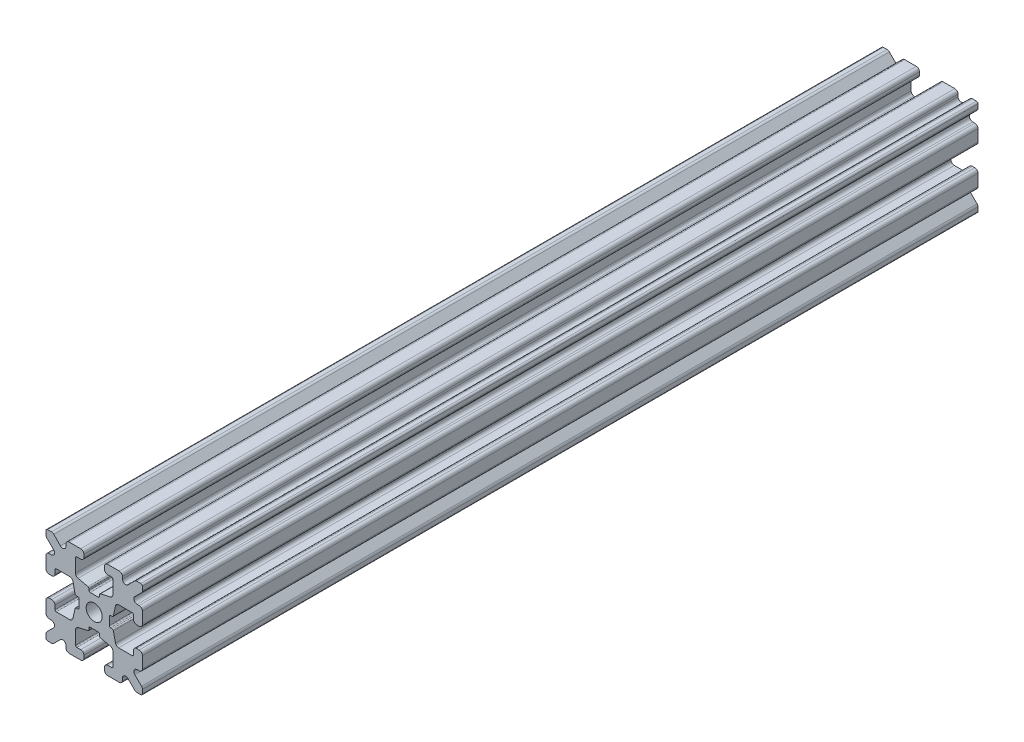
from build123d import *

# Parameters (mm, degrees)
SKETCH1_W           = 15
SKETCH1_H           = 15
SKETCH1_R           = 1.25
BOSS_EXTRUDE1_DEPTH = 65
FILLET1_R           = 0.25
CUT_EXTRUDE1_DEPTH  = 131.431974607
CUT_EXTRUDE3_DEPTH  = 131.431974607
FILLET3_R           = 0.5
FILLET4_R           = 0.5
FILLET5_R           = 3
FILLET6_R           = 0.2
CUT_EXTRUDE4_DEPTH  = 131.431974607
FILLET8_R           = 0.5
SKETCH6_W           = 5.1529354
SKETCH6_H           = 1.651
SKETCH6_W_2         = 1.651
SKETCH6_H_2         = 5.1529354
CUT_EXTRUDE5_DEPTH  = 131.431974607
FILLET10_R          = 0.2


with BuildPart() as part:
    # Sketch1 → Boss-Extrude1 (new, symmetric)
    with BuildSketch(Plane.XY):
        Rectangle(SKETCH1_W, SKETCH1_H)
        Circle(SKETCH1_R, mode=Mode.SUBTRACT)
    extrude(amount=BOSS_EXTRUDE1_DEPTH, both=True)

    # Fillet1
    fillet1_edges = [part.edges().sort_by_distance(p)[0] for p in [
        (7.5, -7.5, 0),
        (-7.5, -7.5, 0),
        (-7.5, 7.5, 0),
        (7.5, 7.5, 0),
    ]]
    fillet(fillet1_edges, radius=FILLET1_R)

    # Sketch2 → Cut-Extrude1 (cut, through all)
    with BuildSketch(Plane.XY.offset(65)):
        Polygon((-7.5, 1.6), (-6.1, 1.6), (-6.1, 2.9), (-3.4, 2.9), (-3.4, -2.9), (-6.1, -2.9), (-6.1, -1.6), (-7.5, -1.6), align=None)
        Polygon((2.9, 6.1), (1.6, 6.1), (1.6, 7.5), (-1.6, 7.5), (-1.6, 6.1), (-2.9, 6.1), (-2.9, 3.4), (2.9, 3.4), align=None)
        Polygon((-1.6, -7.5), (-1.6, -6.1), (-2.9, -6.1), (-2.9, -3.4), (2.9, -3.4), (2.9, -6.1), (1.6, -6.1), (1.6, -7.5), align=None)
        Polygon((6.1, -2.9), (6.1, -1.6), (7.5, -1.6), (7.5, 1.6), (6.1, 1.6), (6.1, 2.9), (3.4, 2.9), (3.4, -2.9), align=None)
    extrude(amount=-CUT_EXTRUDE1_DEPTH, mode=Mode.SUBTRACT)

    # Sketch4 → Cut-Extrude3 (cut, through all)
    with BuildSketch(Plane.XY.offset(65)):
        Polygon((-3.4, 2.9), (-2.75, 0), (-3.4, -2.9), align=None)
        Polygon((-2.9, 3.4), (0, 2.75), (2.9, 3.4), align=None)
        Polygon((3.4, 2.9), (2.75, 0), (3.4, -2.9), align=None)
        Polygon((-2.9, -3.4), (0, -2.75), (2.9, -3.4), align=None)
    extrude(amount=-CUT_EXTRUDE3_DEPTH, mode=Mode.SUBTRACT)

    # Fillet3
    fillet3_edges = [part.edges().sort_by_distance(p)[0] for p in [
        (1.6, -7.5, 0),
        (-1.6, -7.5, 0),
        (-1.6, -6.1, 0),
        (1.6, -6.1, 0),
        (6.1, 1.6, 0),
        (7.5, 1.6, 0),
        (7.5, -1.6, 0),
        (6.1, -1.6, 0),
        (-7.5, -1.6, 0),
        (-7.5, 1.6, 0),
        (-6.1, 1.6, 0),
        (-6.1, -1.6, 0),
        (-1.6, 6.1, 0),
        (-1.6, 7.5, 0),
        (1.6, 7.5, 0),
        (1.6, 6.1, 0),
    ]]
    fillet(fillet3_edges, radius=FILLET3_R)

    # Fillet4
    fillet4_edges = [part.edges().sort_by_distance(p)[0] for p in [
        (-2.9, -3.4, 0),
        (2.9, -3.4, 0),
        (3.4, -2.9, 0),
        (3.4, 2.9, 0),
        (-3.4, 2.9, 0),
        (-3.4, -2.9, 0),
        (2.9, 3.4, 0),
        (-2.9, 3.4, 0),
    ]]
    fillet(fillet4_edges, radius=FILLET4_R)

    # Fillet5
    fillet5_edges = [part.edges().sort_by_distance(p)[0] for p in [
        (-2.75, 0, 0),
        (0, 2.75, 0),
        (2.75, 0, 0),
        (0, -2.75, 0),
    ]]
    fillet(fillet5_edges, radius=FILLET5_R)

    # Fillet6
    fillet6_edges = [part.edges().sort_by_distance(p)[0] for p in [
        (-2.9, -6.1, 0),
        (2.9, -6.1, 0),
        (6.1, -2.9, 0),
        (6.1, 2.9, 0),
        (-6.1, 2.9, 0),
        (-6.1, -2.9, 0),
        (2.9, 6.1, 0),
        (-2.9, 6.1, 0),
    ]]
    fillet(fillet6_edges, radius=FILLET6_R)

    # Sketch5 → Cut-Extrude4 (cut, through all)
    with BuildSketch(Plane.XY.offset(65)):
        Polygon((-7.5, 6.439339828), (-5.460660172, 4.4), (-7.5, 4.4), align=None)
        Polygon((-6.439339828, 7.5), (-4.4, 5.460660172), (-4.4, 7.5), align=None)
        Polygon((4.4, 7.5), (6.439339828, 7.5), (4.4, 5.460660172), align=None)
        Polygon((7.5, 6.439339828), (7.5, 4.4), (5.460660172, 4.4), align=None)
        Polygon((7.5, -6.439339828), (5.460660172, -4.4), (7.5, -4.4), align=None)
        Polygon((6.439339828, -7.5), (4.4, -5.460660172), (4.4, -7.5), align=None)
        Polygon((-4.4, -7.5), (-6.439339828, -7.5), (-4.4, -5.460660172), align=None)
        Polygon((-7.5, -6.439339828), (-7.5, -4.4), (-5.460660172, -4.4), align=None)
    extrude(amount=-CUT_EXTRUDE4_DEPTH, mode=Mode.SUBTRACT)

    # Fillet8
    fillet8_edges = [part.edges().sort_by_distance(p)[0] for p in [
        (-7.5, 4.4, 0),
        (-7.5, 6.439339828, 0),
        (-5.460660172, 4.4, 0),
        (7.5, -4.4, 0),
        (7.5, -6.439339828, 0),
        (5.460660172, -4.4, 0),
        (5.460660172, 4.4, 0),
        (7.5, 6.439339828, 0),
        (7.5, 4.4, 0),
        (-4.4, 7.5, 0),
        (-4.4, 5.460660172, 0),
        (-6.439339828, 7.5, 0),
        (-5.460660172, -4.4, 0),
        (-7.5, -6.439339828, 0),
        (-7.5, -4.4, 0),
        (4.4, 5.460660172, 0),
        (4.4, 7.5, 0),
        (6.439339828, 7.5, 0),
        (6.439339828, -7.5, 0),
        (4.4, -7.5, 0),
        (4.4, -5.460660172, 0),
        (-6.439339828, -7.5, 0),
        (-4.4, -5.460660172, 0),
        (-4.4, -7.5, 0),
    ]]
    fillet(fillet8_edges, radius=FILLET8_R)

    # Sketch6 → Cut-Extrude5 (cut, through all)
    with BuildSketch(Plane.XY.offset(65)):
        with Locations((4.9235323, 0)):
            Rectangle(SKETCH6_W, SKETCH6_H)
        with Locations((0, -4.9235323)):
            Rectangle(SKETCH6_W_2, SKETCH6_H_2)
        with Locations((-4.9235323, 0)):
            Rectangle(SKETCH6_W, SKETCH6_H)
        with Locations((0, 4.9235323)):
            Rectangle(SKETCH6_W_2, SKETCH6_H_2)
    extrude(amount=-CUT_EXTRUDE5_DEPTH, mode=Mode.SUBTRACT)

    # Fillet10
    fillet10_edges = [part.edges().sort_by_distance(p)[0] for p in [
        (0.8255, -2.935025862, 0),
        (-0.8255, -2.935025862, 0),
        (0.8255, -2.3470646, 0),
        (-0.8255, -2.3470646, 0),
        (2.935025862, 0.8255, 0),
        (2.935025862, -0.8255, 0),
        (2.3470646, 0.8255, 0),
        (2.3470646, -0.8255, 0),
        (-2.935025862, -0.8255, 0),
        (-2.935025862, 0.8255, 0),
        (-2.3470646, -0.8255, 0),
        (-2.3470646, 0.8255, 0),
        (-0.8255, 2.935025862, 0),
        (0.8255, 2.935025862, 0),
        (-0.8255, 2.3470646, 0),
        (0.8255, 2.3470646, 0),
    ]]
    fillet(fillet10_edges, radius=FILLET10_R)


solid = part.part
